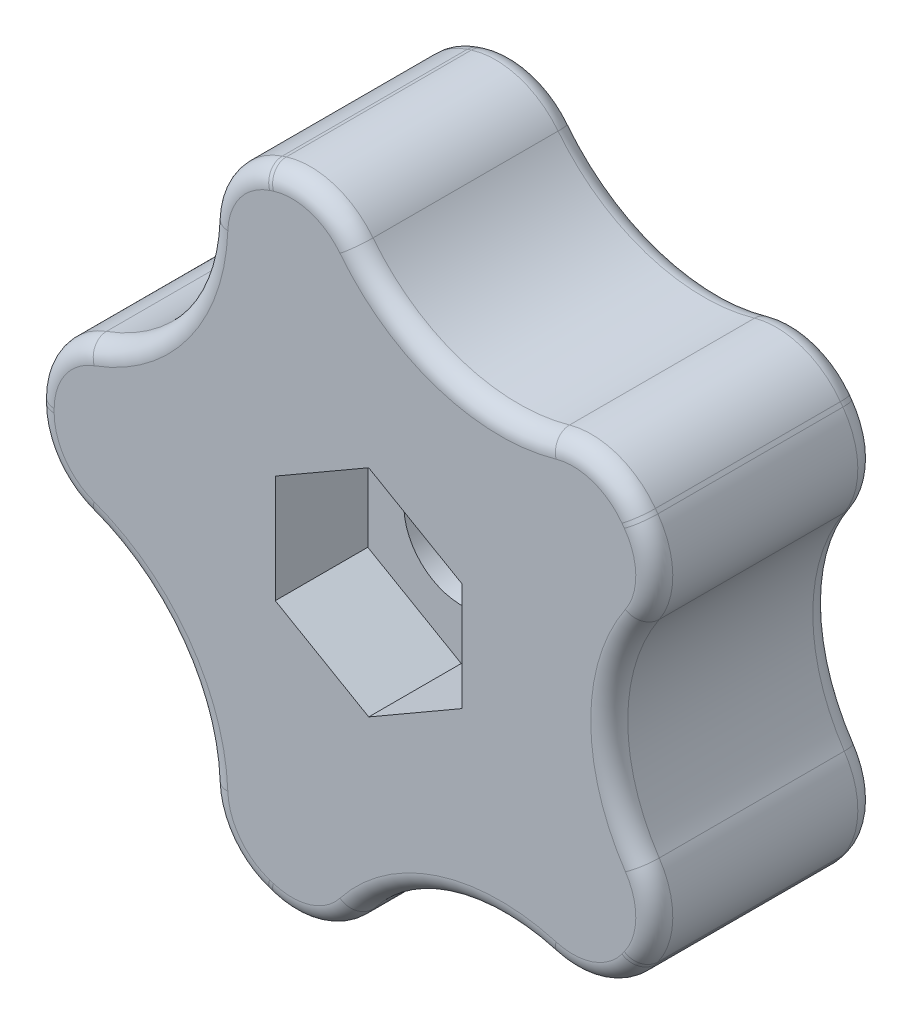
from build123d import *

# Parameters (mm, degrees)
ESQUISSE1_R                  = 18
BOSS_EXTRU_1_DEPTH           = 12
ESQUISSE2_R                  = 6
BOSS_EXTRU_2_DEPTH           = 3
ENL_V_MAT_EXTRU_1_DEPTH      = 30.546573405
ENL_V_MAT_EXTRU_1_DEPTH_BACK = 30.546573405
ESQUISSE3_R                  = 3.1
ENL_V_MAT_EXTRU_3_DEPTH      = 30.546573405
ENL_V_MAT_EXTRU_3_DEPTH_BACK = 30.546573405
CONG_1_R                     = 4.3
CONG_2_R                     = 1
CHANFREIN1_SIZE              = 1.5
ENL_V_MAT_EXTRU_4_DEPTH      = 5


with BuildPart() as part:
    # Esquisse1 → Boss.-Extru.1 (new body)
    with BuildSketch(Plane.XY):
        Circle(ESQUISSE1_R)
    extrude(amount=BOSS_EXTRU_1_DEPTH)

    # Esquisse2 → Boss.-Extru.2 (add)
    with BuildSketch(Plane(origin=(0, 0, 0), x_dir=(-1, 0, 0), z_dir=(0, 0, -1))):
        Circle(ESQUISSE2_R)
    extrude(amount=BOSS_EXTRU_2_DEPTH)

    # Esquisse3 → Enlèv. mat.-Extru.1 (cut, two sides: drawn at the far end of the back side and taken through both)
    with BuildSketch(Plane.XY.offset(12).offset(-ENL_V_MAT_EXTRU_1_DEPTH_BACK)):
        Circle(ESQUISSE3_R)
    extrude(amount=ENL_V_MAT_EXTRU_1_DEPTH + ENL_V_MAT_EXTRU_1_DEPTH_BACK, mode=Mode.SUBTRACT)

    # Esquisse5 → Enlèv. mat.-Extru.3 (cut, two sides: drawn at the far end of the back side and taken through both)
    with BuildSketch(Plane.XY.offset(12).offset(-ENL_V_MAT_EXTRU_3_DEPTH_BACK)):
        with BuildLine():
            ThreePointArc((16.369565217, -7.48580888), (13, 0), (16.369565217, 7.48580888))
            ThreePointArc((16.369565217, 7.48580888), (18, 0), (16.369565217, -7.48580888))
        make_face()
        with BuildLine():
            ThreePointArc((-2.060953473, -17.88162383), (4.017220927, -12.363734712), (12.177901158, -13.255139508))
            ThreePointArc((12.177901158, -13.255139508), (5.562305899, -17.119017293), (-2.060953473, -17.88162383))
        make_face()
        with BuildLine():
            ThreePointArc((-17.643304513, -3.56564242), (-10.517220927, -7.64120828), (-8.84320839, -15.677935622))
            ThreePointArc((-8.84320839, -15.677935622), (-14.562305899, -10.580134541), (-17.643304513, -3.56564242))
        make_face()
        with BuildLine():
            ThreePointArc((-8.84320839, 15.677935622), (-10.517220927, 7.64120828), (-17.643304513, 3.56564242))
            ThreePointArc((-17.643304513, 3.56564242), (-14.562305899, 10.580134541), (-8.84320839, 15.677935622))
        make_face()
        with BuildLine():
            ThreePointArc((12.177901158, 13.255139508), (4.017220927, 12.363734712), (-2.060953473, 17.88162383))
            ThreePointArc((-2.060953473, 17.88162383), (5.562305899, 17.119017293), (12.177901158, 13.255139508))
        make_face()
    extrude(amount=ENL_V_MAT_EXTRU_3_DEPTH + ENL_V_MAT_EXTRU_3_DEPTH_BACK, mode=Mode.SUBTRACT)

    # Congé1
    cong_1_edges = [part.edges().sort_by_distance(p)[0] for p in [
        (16.369565217, 7.48580888, 6),
        (16.369565217, -7.48580888, 6),
        (12.177901158, -13.255139508, 6),
        (-2.060953473, -17.88162383, 6),
        (-8.84320839, -15.677935622, 6),
        (-17.643304513, -3.56564242, 6),
        (-17.643304513, 3.56564242, 6),
        (-8.84320839, 15.677935622, 6),
        (-2.060953473, 17.88162383, 6),
        (12.177901158, 13.255139508, 6),
    ]]
    fillet(cong_1_edges, radius=CONG_1_R)

    # Congé2
    cong_2_edges = [part.edges().sort_by_distance(p)[0] for p in [
        (12.421312985, -12.192660969, 12),
        (-2.882386993, -17.165134517, 12),
        (-7.757512861, -15.581110101, 12),
        (-5.562305899, -17.119017293, 0),
        (14.562305899, 10.580134541, 0),
        (13, 0, 0),
        (14.562305899, -10.580134541, 0),
        (4.017220927, -12.363734712, 0),
        (-18, 0, 0),
        (-10.517220927, 7.64120828, 0),
        (-5.562305899, 17.119017293, 0),
        (4.017220927, 12.363734712, 0),
        (-17.215719601, -2.563005344, 0),
        (-17.215719601, 2.563005344, 0),
        (-7.757512861, 15.581110101, 0),
        (-2.882386993, 17.165134517, 0),
        (12.421312985, 12.192660969, 0),
        (15.434306471, 8.045631209, 0),
        (15.434306471, -8.045631209, 0),
        (12.421312985, -12.192660969, 0),
        (-2.882386993, -17.165134517, 0),
        (-7.757512861, -15.581110101, 0),
        (-10.517220927, -7.64120828, 12),
        (-10.517220927, -7.64120828, 0),
        (13, 0, 12),
        (14.562305899, 10.580134541, 12),
        (4.017220927, 12.363734712, 12),
        (-5.562305899, 17.119017293, 12),
        (-10.517220927, 7.64120828, 12),
        (-18, 0, 12),
        (-5.562305899, -17.119017293, 12),
        (4.017220927, -12.363734712, 12),
        (14.562305899, -10.580134541, 12),
        (-17.215719601, -2.563005344, 12),
        (-17.215719601, 2.563005344, 12),
        (-7.757512861, 15.581110101, 12),
        (-2.882386993, 17.165134517, 12),
        (12.421312985, 12.192660969, 12),
        (15.434306471, 8.045631209, 12),
        (15.434306471, -8.045631209, 12),
    ]]
    fillet(cong_2_edges, radius=CONG_2_R)

    # Chanfrein1
    chanfrein1_edges = [part.edges().sort_by_distance(p)[0] for p in [
        (6, 0, 0),
    ]]
    chamfer(chanfrein1_edges, length=CHANFREIN1_SIZE)

    # Esquisse6 → Enlèv. mat.-Extru.4 (cut)
    with BuildSketch(Plane.XY.offset(12)):
        Polygon((5.05, -2.915618859), (5.05, 2.915618859), (0, 5.831237719), (-5.05, 2.915618859), (-5.05, -2.915618859), (0, -5.831237719), align=None)
    extrude(amount=-ENL_V_MAT_EXTRU_4_DEPTH, mode=Mode.SUBTRACT)


solid = part.part
